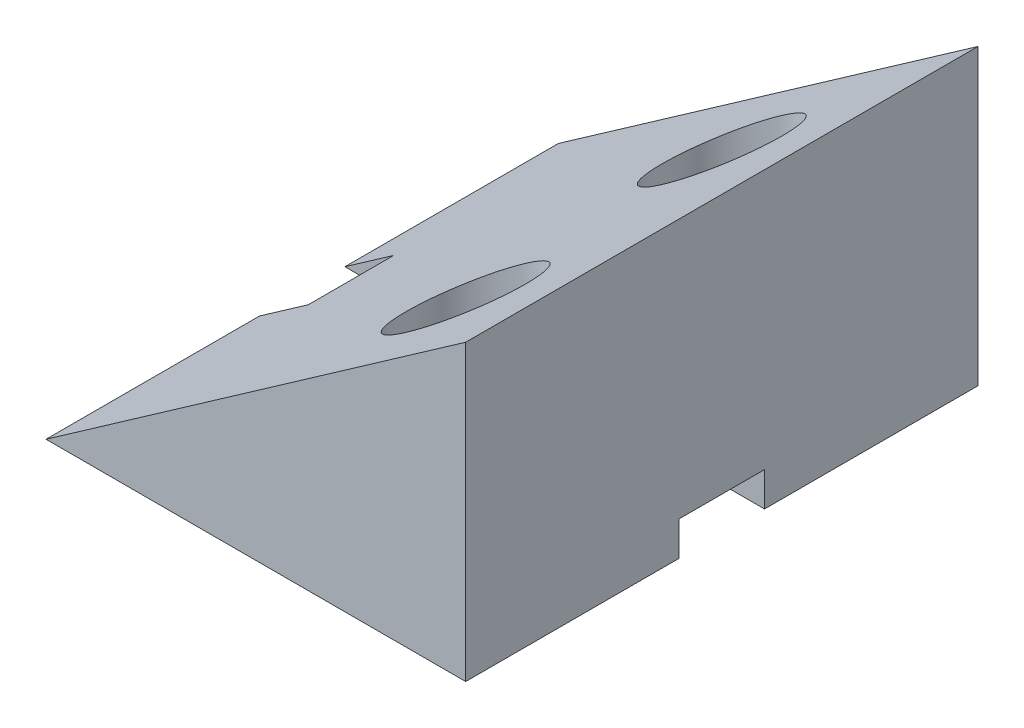
from build123d import *

# Parameters (mm, degrees)
BOSS_EXTRU_1_DEPTH      = 30
ENL_V_MAT_EXTRU_1_REACH = 42.367
ESQUISSE2_R             = 3.5
ENL_V_MAT_EXTRU_2_REACH = 42.367
ESQUISSE3_R             = 1.75
ENL_V_MAT_EXTRU_3_REACH = 44.426
ESQUISSE4_W             = 5
ESQUISSE4_H             = 2


with BuildPart() as part:
    # Esquisse1 → Boss.-Extru.1 (new body)
    with BuildSketch(Plane.XY):
        Polygon((0, 0), (-24.574561329, 0), (0, 17.207293091), align=None)
    extrude(amount=BOSS_EXTRU_1_DEPTH)

    # Enlèv. mat.-Extru.1: up to this plane
    enl_v_mat_extru_1_end = Plane(origin=(-24.574561329, 0, 30), z_dir=(0.5735764363510414, -0.8191520442889951, 0))
    # Esquisse2 → Enlèv. mat.-Extru.1 (cut, up to the surface)
    with BuildSketch(Plane(origin=(0, 6, 0), x_dir=(-1, 0, 0), z_dir=(0, -1, 0)), mode=Mode.PRIVATE) as enl_v_mat_extru_1_sk1:
        with Locations(Location((7.5, -7.5, 0), (0, 0, 180))):
            Circle(ESQUISSE2_R)
    enl_v_mat_extru_1_tool1 = split(extrude(enl_v_mat_extru_1_sk1.sketch, amount=-ENL_V_MAT_EXTRU_1_REACH, mode=Mode.PRIVATE), bisect_by=enl_v_mat_extru_1_end, keep=Keep.BOTH, mode=Mode.PRIVATE)
    add(enl_v_mat_extru_1_tool1.solids().sort_by_distance((-7.5, 6, 7.5))[0], mode=Mode.SUBTRACT)
    # Esquisse2 → Enlèv. mat.-Extru.1 (cut, up to the surface)
    with BuildSketch(Plane(origin=(0, 6, 0), x_dir=(-1, 0, 0), z_dir=(0, -1, 0)), mode=Mode.PRIVATE) as enl_v_mat_extru_1_sk2:
        with Locations(Location((7.5, -22.5, 0), (0, 0, 180))):
            Circle(ESQUISSE2_R)
    enl_v_mat_extru_1_tool2 = split(extrude(enl_v_mat_extru_1_sk2.sketch, amount=-ENL_V_MAT_EXTRU_1_REACH, mode=Mode.PRIVATE), bisect_by=enl_v_mat_extru_1_end, keep=Keep.BOTH, mode=Mode.PRIVATE)
    add(enl_v_mat_extru_1_tool2.solids().sort_by_distance((-7.5, 6, 22.5))[0], mode=Mode.SUBTRACT)

    # Esquisse3 → Enlèv. mat.-Extru.2 (cut, up to next)
    with BuildSketch(Plane(origin=(0, 6, 0), x_dir=(1, 0, 0), z_dir=(0, 1, 0)), mode=Mode.PRIVATE) as enl_v_mat_extru_2_sk1:
        with Locations(Location((-7.5, -22.5, 0), (0, 0, 180))):
            Circle(ESQUISSE3_R)
    enl_v_mat_extru_2_tool1 = extrude(enl_v_mat_extru_2_sk1.sketch, amount=-ENL_V_MAT_EXTRU_2_REACH, mode=Mode.PRIVATE) & part.part
    # Esquisse3 → Enlèv. mat.-Extru.2 (cut, up to next)
    with BuildSketch(Plane(origin=(0, 6, 0), x_dir=(1, 0, 0), z_dir=(0, 1, 0)), mode=Mode.PRIVATE) as enl_v_mat_extru_2_sk2:
        with Locations(Location((-7.5, -7.5, 0), (0, 0, 180))):
            Circle(ESQUISSE3_R)
    enl_v_mat_extru_2_tool2 = extrude(enl_v_mat_extru_2_sk2.sketch, amount=-ENL_V_MAT_EXTRU_2_REACH, mode=Mode.PRIVATE) & part.part
    add(enl_v_mat_extru_2_tool1.solids().sort_by_distance((-7.5, 6, 22.5))[0], mode=Mode.SUBTRACT)
    add(enl_v_mat_extru_2_tool2.solids().sort_by_distance((-7.5, 6, 7.5))[0], mode=Mode.SUBTRACT)

    # Enlèv. mat.-Extru.3: up to this plane
    enl_v_mat_extru_3_end = Plane(origin=(-24.574561329, 0, 30), z_dir=(0.5735764363510414, -0.8191520442889951, 0))
    # Esquisse4 → Enlèv. mat.-Extru.3 (cut, up to the surface)
    with BuildSketch(Plane(origin=(0, 0, 0), x_dir=(0, 0, -1), z_dir=(1, 0, 0)), mode=Mode.PRIVATE) as enl_v_mat_extru_3_sk1:
        with Locations((-15, 1)):
            Rectangle(ESQUISSE4_W, ESQUISSE4_H)
    enl_v_mat_extru_3_tool1 = split(extrude(enl_v_mat_extru_3_sk1.sketch, amount=-ENL_V_MAT_EXTRU_3_REACH, mode=Mode.PRIVATE), bisect_by=enl_v_mat_extru_3_end, keep=Keep.BOTH, mode=Mode.PRIVATE)
    add(enl_v_mat_extru_3_tool1.solids().sort_by_distance((0, 1, 15))[0], mode=Mode.SUBTRACT)


solid = part.part
